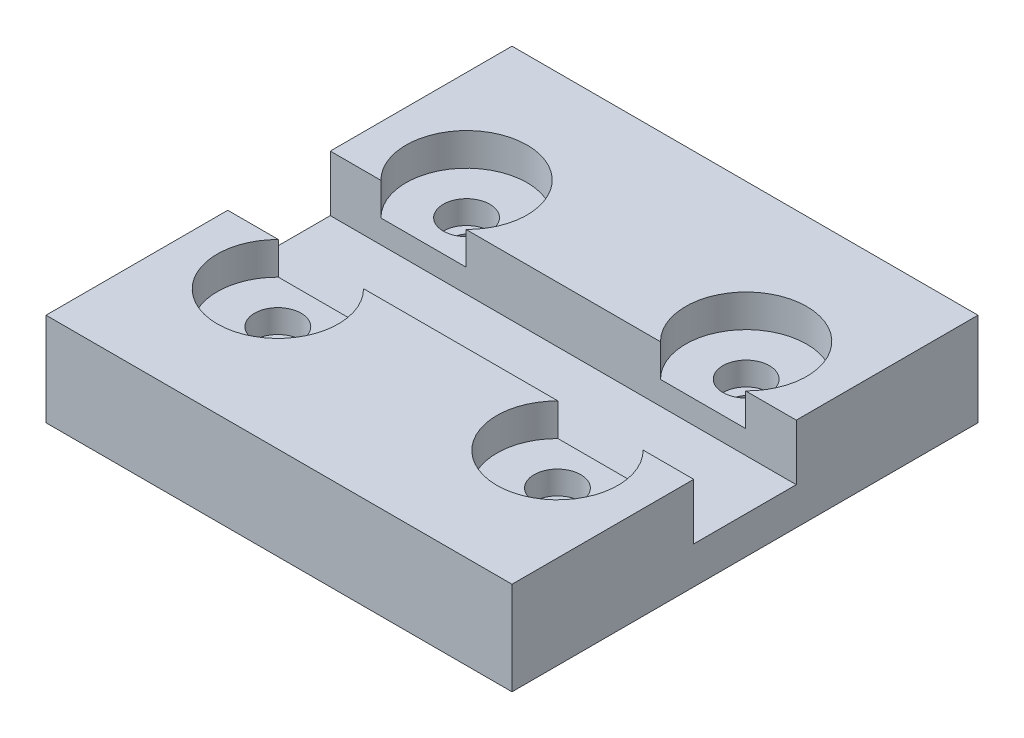
from build123d import *

# Parameters (mm, degrees)
SKETCH2_W           = 100
SKETCH2_H           = 100
BOSS_EXTRUDE1_DEPTH = 20
SKETCH3_W           = 100
SKETCH3_H           = 20
CUT_EXTRUDE1_DEPTH  = 12
SKETCH5_R           = 13
CUT_EXTRUDE2_DEPTH  = 7
SKETCH6_R           = 13
CUT_EXTRUDE3_DEPTH  = 7
SKETCH8_R           = 13
CUT_EXTRUDE5_DEPTH  = 7
SKETCH7_R           = 13
CUT_EXTRUDE10_DEPTH = 7
SKETCH13_R          = 2.75
CUT_EXTRUDE11_DEPTH = 128.4313455
SKETCH14_R          = 2.75
CUT_EXTRUDE12_DEPTH = 128.4313455
SKETCH15_R          = 2.75
CUT_EXTRUDE13_DEPTH = 128.4313455
SKETCH16_R          = 2.75
CUT_EXTRUDE14_DEPTH = 128.4313455
CUT_EXTRUDE15_DEPTH = 5
CUT_EXTRUDE16_DEPTH = 5
CUT_EXTRUDE17_DEPTH = 5
CUT_EXTRUDE18_DEPTH = 5
SKETCH22_W          = 100
SKETCH22_H          = 12
CUT_EXTRUDE19_DEPTH = 1
SKETCH23_W          = 100
SKETCH23_H          = 12
CUT_EXTRUDE20_DEPTH = 1
SKETCH24_R          = 5
CUT_EXTRUDE21_DEPTH = 5
SKETCH25_R          = 5
CUT_EXTRUDE22_DEPTH = 5
SKETCH26_R          = 5
CUT_EXTRUDE23_DEPTH = 5
SKETCH27_R          = 5
CUT_EXTRUDE24_DEPTH = 5


with BuildPart() as part:
    # Sketch2 → Boss-Extrude1 (new body)
    with BuildSketch(Plane(origin=(0, 0, 0), x_dir=(1, 0, 0), z_dir=(0, 1, 0))):
        with Locations((-37.64268429, -41.588796838)):
            Rectangle(SKETCH2_W, SKETCH2_H)
    extrude(amount=BOSS_EXTRUDE1_DEPTH)

    # Sketch3 → Cut-Extrude1 (cut)
    with BuildSketch(Plane(origin=(0, 20, 0), x_dir=(1, 0, 0), z_dir=(0, 1, 0))):
        with Locations((-37.64268429, -41.588796838)):
            Rectangle(SKETCH3_W, SKETCH3_H)
    extrude(amount=-CUT_EXTRUDE1_DEPTH, mode=Mode.SUBTRACT)

    # Sketch5 → Cut-Extrude2 (cut)
    with BuildSketch(Plane(origin=(0, 20, 0), x_dir=(1, 0, 0), z_dir=(0, 1, 0))):
        with Locations((-7.64268429, -61.838796838)):
            Circle(SKETCH5_R)
    extrude(amount=-CUT_EXTRUDE2_DEPTH, mode=Mode.SUBTRACT)

    # Sketch6 → Cut-Extrude3 (cut)
    with BuildSketch(Plane(origin=(0, 20, 0), x_dir=(1, 0, 0), z_dir=(0, 1, 0))):
        with Locations((-67.64268429, -61.838796838)):
            Circle(SKETCH6_R)
    extrude(amount=-CUT_EXTRUDE3_DEPTH, mode=Mode.SUBTRACT)

    # Sketch8 → Cut-Extrude5 (cut)
    with BuildSketch(Plane(origin=(0, 20, 0), x_dir=(1, 0, 0), z_dir=(0, 1, 0))):
        with Locations((-7.64268429, -21.338796838)):
            Circle(SKETCH8_R)
    extrude(amount=-CUT_EXTRUDE5_DEPTH, mode=Mode.SUBTRACT)

    # Sketch7 → Cut-Extrude10 (cut)
    with BuildSketch(Plane(origin=(0, 20, 0), x_dir=(1, 0, 0), z_dir=(0, 1, 0))):
        with Locations((-67.64268429, -21.338796838)):
            Circle(SKETCH7_R)
    extrude(amount=-CUT_EXTRUDE10_DEPTH, mode=Mode.SUBTRACT)

    # Sketch13 → Cut-Extrude11 (cut, through all)
    with BuildSketch(Plane(origin=(0, 13, 0), x_dir=(1, 0, 0), z_dir=(0, 1, 0))):
        with Locations(Location((-67.64268429, -21.338796838, 0), (0, 0, 270))):
            Circle(SKETCH13_R)
    extrude(amount=-CUT_EXTRUDE11_DEPTH, mode=Mode.SUBTRACT)

    # Sketch14 → Cut-Extrude12 (cut, through all)
    with BuildSketch(Plane(origin=(0, 13, 0), x_dir=(1, 0, 0), z_dir=(0, 1, 0))):
        with Locations(Location((-7.64268429, -21.338796838, 0), (0, 0, 270))):
            Circle(SKETCH14_R)
    extrude(amount=-CUT_EXTRUDE12_DEPTH, mode=Mode.SUBTRACT)

    # Sketch15 → Cut-Extrude13 (cut, through all)
    with BuildSketch(Plane(origin=(0, 13, 0), x_dir=(1, 0, 0), z_dir=(0, 1, 0))):
        with Locations(Location((-7.64268429, -61.838796838, 0), (0, 0, 270))):
            Circle(SKETCH15_R)
    extrude(amount=-CUT_EXTRUDE13_DEPTH, mode=Mode.SUBTRACT)

    # Sketch16 → Cut-Extrude14 (cut, through all)
    with BuildSketch(Plane(origin=(0, 13, 0), x_dir=(1, 0, 0), z_dir=(0, 1, 0))):
        with Locations(Location((-67.64268429, -61.838796838, 0), (0, 0, 270))):
            Circle(SKETCH16_R)
    extrude(amount=-CUT_EXTRUDE14_DEPTH, mode=Mode.SUBTRACT)

    # Sketch17 → Cut-Extrude15 (cut)
    with BuildSketch(Plane(origin=(0, 0, 0), x_dir=(-1, 0, 0), z_dir=(0, -1, 0))):
        Polygon((7.64268429, -26.246274126), (11.89268429, -23.792535482), (11.89268429, -18.885058194), (7.64268429, -16.43131955), (3.39268429, -18.885058194), (3.39268429, -23.792535482), align=None)
    extrude(amount=-CUT_EXTRUDE15_DEPTH, mode=Mode.SUBTRACT)

    # Sketch19 → Cut-Extrude16 (cut)
    with BuildSketch(Plane.XZ):
        Polygon((-67.64268429, 26.246274126), (-71.89268429, 23.792535482), (-71.89268429, 18.885058194), (-67.64268429, 16.43131955), (-63.39268429, 18.885058194), (-63.39268429, 23.792535482), align=None)
    extrude(amount=-CUT_EXTRUDE16_DEPTH, mode=Mode.SUBTRACT)

    # Sketch20 → Cut-Extrude17 (cut)
    with BuildSketch(Plane.XZ):
        Polygon((-67.64268429, 66.746274126), (-71.89268429, 64.292535482), (-71.89268429, 59.385058194), (-67.64268429, 56.93131955), (-63.39268429, 59.385058194), (-63.39268429, 64.292535482), align=None)
    extrude(amount=-CUT_EXTRUDE17_DEPTH, mode=Mode.SUBTRACT)

    # Sketch21 → Cut-Extrude18 (cut)
    with BuildSketch(Plane.XZ):
        Polygon((-7.64268429, 66.746274126), (-11.89268429, 64.292535482), (-11.89268429, 59.385058194), (-7.64268429, 56.93131955), (-3.39268429, 59.385058194), (-3.39268429, 64.292535482), align=None)
    extrude(amount=-CUT_EXTRUDE18_DEPTH, mode=Mode.SUBTRACT)

    # Sketch22 → Cut-Extrude19 (cut)
    with BuildSketch(Plane.XY.offset(31.588796838)):
        with Locations((-37.64268429, 14)):
            Rectangle(SKETCH22_W, SKETCH22_H)
    extrude(amount=-CUT_EXTRUDE19_DEPTH, mode=Mode.SUBTRACT)

    # Sketch23 → Cut-Extrude20 (cut)
    with BuildSketch(Plane(origin=(0, 0, 51.588796838), x_dir=(-1, 0, 0), z_dir=(0, 0, -1))):
        with Locations((37.64268429, 14)):
            Rectangle(SKETCH23_W, SKETCH23_H)
    extrude(amount=-CUT_EXTRUDE20_DEPTH, mode=Mode.SUBTRACT)

    # Sketch24 → Cut-Extrude21 (cut)
    with BuildSketch(Plane(origin=(0, 13, 0), x_dir=(1, 0, 0), z_dir=(0, 1, 0))):
        with Locations(Location((-67.64268429, -61.838796838, 0), (0, 0, 270))):
            Circle(SKETCH24_R)
    extrude(amount=-CUT_EXTRUDE21_DEPTH, mode=Mode.SUBTRACT)

    # Sketch25 → Cut-Extrude22 (cut)
    with BuildSketch(Plane(origin=(0, 13, 0), x_dir=(1, 0, 0), z_dir=(0, 1, 0))):
        with Locations(Location((-7.64268429, -61.838796838, 0), (0, 0, 270))):
            Circle(SKETCH25_R)
    extrude(amount=-CUT_EXTRUDE22_DEPTH, mode=Mode.SUBTRACT)

    # Sketch26 → Cut-Extrude23 (cut)
    with BuildSketch(Plane(origin=(0, 13, 0), x_dir=(1, 0, 0), z_dir=(0, 1, 0))):
        with Locations(Location((-7.64268429, -21.338796838, 0), (0, 0, 270))):
            Circle(SKETCH26_R)
    extrude(amount=-CUT_EXTRUDE23_DEPTH, mode=Mode.SUBTRACT)

    # Sketch27 → Cut-Extrude24 (cut)
    with BuildSketch(Plane(origin=(0, 13, 0), x_dir=(1, 0, 0), z_dir=(0, 1, 0))):
        with Locations(Location((-67.64268429, -21.338796838, 0), (0, 0, 270))):
            Circle(SKETCH27_R)
    extrude(amount=-CUT_EXTRUDE24_DEPTH, mode=Mode.SUBTRACT)


solid = part.part
